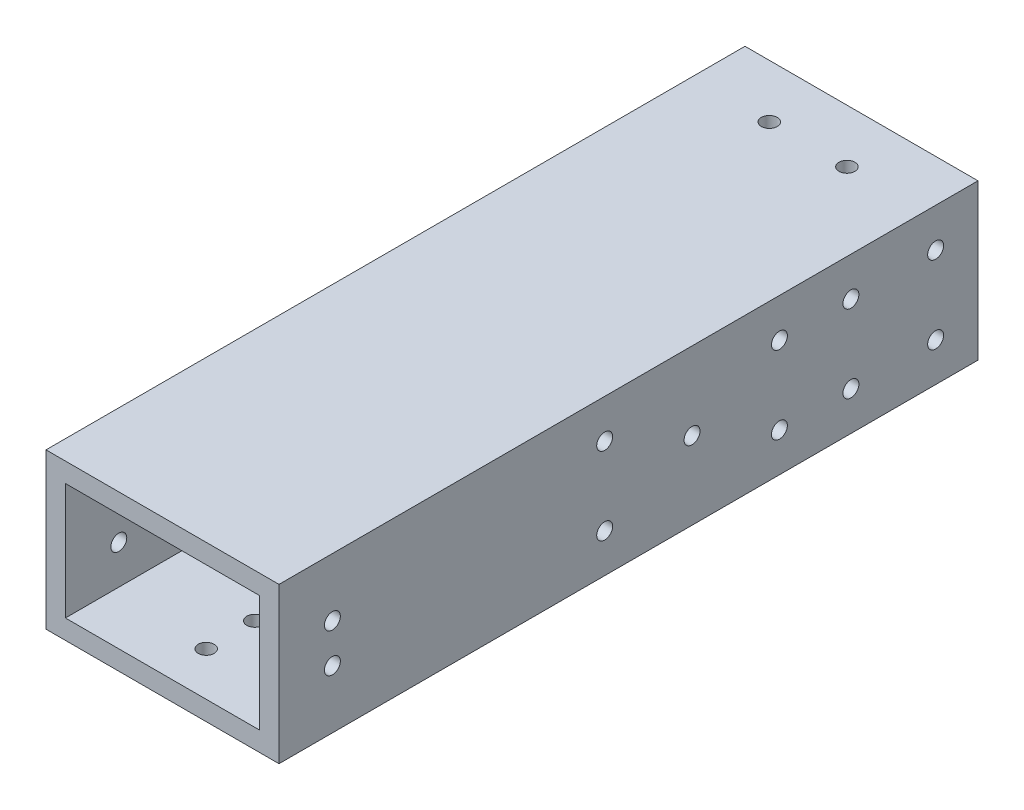
from build123d import *

# Parameters (mm, degrees)
BOSS_EXTRUDE1_DEPTH      = 152.4
BOSS_EXTRUDE1_DEPTH_BACK = 76.2
SKETCH1_W                = 76.2
SKETCH1_H                = 50.8
SKETCH1_W_2              = 63.5
SKETCH1_H_2              = 38.1
CUT_EXTRUDE1_DEPTH       = 804.658803572
CUT_EXTRUDE1_DEPTH_BACK  = 804.658803572
SKETCH2_R                = 2.6035
SKETCH2_R_2              = 2.603499999
SKETCH3_R                = 2.6035
CUT_EXTRUDE2_DEPTH       = 807.363629238
SKETCH4_R                = 2.6035
CUT_EXTRUDE3_DEPTH       = 166.1
CUT_EXTRUDE4_REACH       = 167.1
SKETCH5_R                = 2.6035


with BuildPart() as part:
    # Sketch1 → Boss-Extrude1 (new, two sides: drawn at the far end of the back side and taken through both)
    with BuildSketch(Plane.XY.offset(-BOSS_EXTRUDE1_DEPTH_BACK)):
        with Locations((0, 762.756140976)):
            Rectangle(SKETCH1_W, SKETCH1_H)
        with Locations((0, 762.756140976)):
            Rectangle(SKETCH1_W_2, SKETCH1_H_2, mode=Mode.SUBTRACT)
    extrude(amount=BOSS_EXTRUDE1_DEPTH + BOSS_EXTRUDE1_DEPTH_BACK)

    # Sketch2 → Cut-Extrude1 (cut, two sides: drawn at the far end of the back side and taken through both)
    with BuildSketch(Plane(origin=(0, 0, 0), x_dir=(0, 0, -1), z_dir=(1, 0, 0)).offset(-CUT_EXTRUDE1_DEPTH_BACK)):
        with Locations((62.346011746, 750.056140976)):
            Circle(SKETCH2_R)
        with Locations(Location((34.638035237, 750.056140976, 0), (0, 0, 90))):
            Circle(SKETCH2_R)
        with Locations((34.638035237, 775.456140976)):
            Circle(SKETCH2_R)
        with Locations(Location((62.346011746, 775.456140976, 0), (0, 0, 90))):
            Circle(SKETCH2_R)
        with Locations((11.259046982, 750.056140976)):
            Circle(SKETCH2_R_2)
        with Locations((11.259046982, 775.456140976)):
            Circle(SKETCH2_R_2)
        with Locations((-17.315953018, 762.756140976)):
            Circle(SKETCH2_R_2)
        with Locations((-45.890953018, 775.456140976)):
            Circle(SKETCH2_R_2)
        with Locations((-45.890953018, 750.056140976)):
            Circle(SKETCH2_R_2)
    extrude(amount=CUT_EXTRUDE1_DEPTH + CUT_EXTRUDE1_DEPTH_BACK, mode=Mode.SUBTRACT)

    # Sketch3 → Cut-Extrude2 (cut, through all)
    with BuildSketch(Plane(origin=(38.1, 0, 0), x_dir=(0, 0, -1), z_dir=(1, 0, 0))):
        with Locations((-134.9375, 769.106140976)):
            Circle(SKETCH3_R)
        with Locations((-134.9375, 756.406140976)):
            Circle(SKETCH3_R)
    extrude(amount=-CUT_EXTRUDE2_DEPTH, mode=Mode.SUBTRACT)

    # Sketch4 → Cut-Extrude3 (cut, through all)
    with BuildSketch(Plane(origin=(0, 788.156140976, 0), x_dir=(1, 0, 0), z_dir=(0, 1, 0))):
        with Locations(Location((12.7, 58.7375, 0), (0, 0, 270))):
            Circle(SKETCH4_R)
        with Locations(Location((-12.7, 58.7375, 0), (0, 0, 270))):
            Circle(SKETCH4_R)
    extrude(amount=-CUT_EXTRUDE3_DEPTH, mode=Mode.SUBTRACT)

    # Sketch5 → Cut-Extrude4 (cut, up to next)
    with BuildSketch(Plane.XZ.offset(-737.356140976), mode=Mode.PRIVATE) as cut_extrude4_sk1:
        with Locations(Location((0, 138.1125, 0), (0, 0, 270))):
            Circle(SKETCH5_R)
    cut_extrude4_tool1 = extrude(cut_extrude4_sk1.sketch, amount=-CUT_EXTRUDE4_REACH, mode=Mode.PRIVATE) & part.part
    # Sketch5 → Cut-Extrude4 (cut, up to next)
    with BuildSketch(Plane.XZ.offset(-737.356140976), mode=Mode.PRIVATE) as cut_extrude4_sk2:
        with Locations(Location((0, 122.2375, 0), (0, 0, 270))):
            Circle(SKETCH5_R)
    cut_extrude4_tool2 = extrude(cut_extrude4_sk2.sketch, amount=-CUT_EXTRUDE4_REACH, mode=Mode.PRIVATE) & part.part
    add(cut_extrude4_tool1.solids().sort_by_distance((0, 737.356141, 138.1125))[0], mode=Mode.SUBTRACT)
    add(cut_extrude4_tool2.solids().sort_by_distance((0, 737.356141, 122.2375))[0], mode=Mode.SUBTRACT)


solid = part.part
